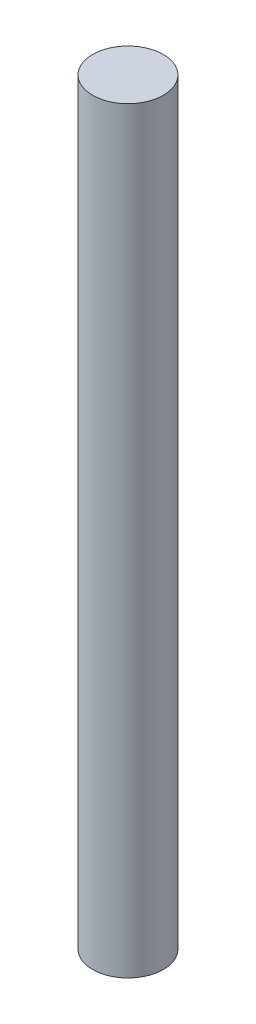
from build123d import *

# Parameters (mm, degrees)
SKETCH1_R           = 1.5875
BOSS_EXTRUDE1_DEPTH = 34


with BuildPart() as part:
    # Sketch1 → Boss-Extrude1 (new body)
    with BuildSketch(Plane(origin=(0, 0, 0), x_dir=(1, 0, 0), z_dir=(0, 1, 0))):
        with Locations(Location((0, 0, 0), (0, 0, 270))):
            Circle(SKETCH1_R)
    extrude(amount=BOSS_EXTRUDE1_DEPTH)


solid = part.part
